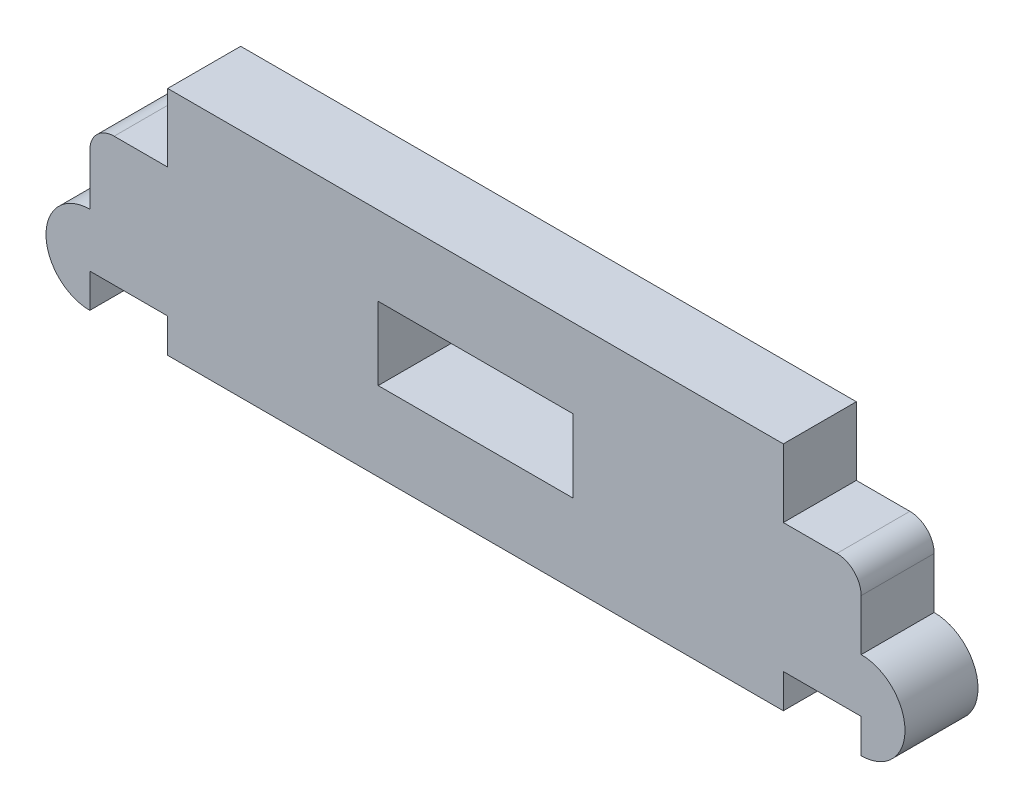
from build123d import *

# Parameters (mm, degrees)
BASE_W                   = 25.3
BASE_H                   = 9.5
RESSALTO_EXTRUS_O1_DEPTH = 3
ESBO_O4_W                = 8
ESBO_O4_H                = 3
CORTE_EXTRUS_O1_DEPTH    = 14.841423337
RESSALTO_EXTRUS_O2_DEPTH = 3
FILETE1_R                = 1
FILETE1_OF_ESPELHAR1_R   = 1


with BuildPart() as part:
    # Base → Ressalto-extrusão1 (new body)
    with BuildSketch(Plane.XY):
        Rectangle(BASE_W, BASE_H)
    extrude(amount=RESSALTO_EXTRUS_O1_DEPTH)

    # Esboço4 → Corte-extrusão1 (cut, through all)
    with BuildSketch(Plane.XY):
        Rectangle(ESBO_O4_W, ESBO_O4_H)
    extrude(amount=CORTE_EXTRUS_O1_DEPTH, mode=Mode.SUBTRACT)

    # Esboço2 → Ressalto-extrusão2 (add, through all)
    with BuildSketch(Plane.XY):
        with BuildLine():
            Line((-12.65, -3.35), (-15.85, -3.35))
            Line((-15.85, -3.35), (-15.85, -4.75))
            ThreePointArc((-15.85, -4.75), (-17.65, -2.95), (-15.85, -1.15))
            Line((-15.85, -1.15), (-15.85, 1.95))
            Line((-15.85, 1.95), (-12.65, 1.95))
            Line((-12.65, 1.95), (-12.65, -3.35))
        make_face()
    ressalto_extrus_o2 = extrude(amount=RESSALTO_EXTRUS_O2_DEPTH)

    # Filete1
    filete1_edges = [part.edges().sort_by_distance(p)[0] for p in [
        (-15.85, 1.95, 1.5),
    ]]
    fillet(filete1_edges, radius=FILETE1_R)

    # Espelhar1: Ressalto-extrusão2 across plane
    add(ressalto_extrus_o2.mirror(Plane(origin=(0, 0, 0), x_dir=(0, 0, 1), z_dir=(1, 0, 0))))

    # Filete1 of Espelhar1
    filete1_of_espelhar1_edges = [part.edges().sort_by_distance(p)[0] for p in [
        (15.85, 1.95, 1.5),
    ]]
    fillet(filete1_of_espelhar1_edges, radius=FILETE1_OF_ESPELHAR1_R)


solid = part.part
